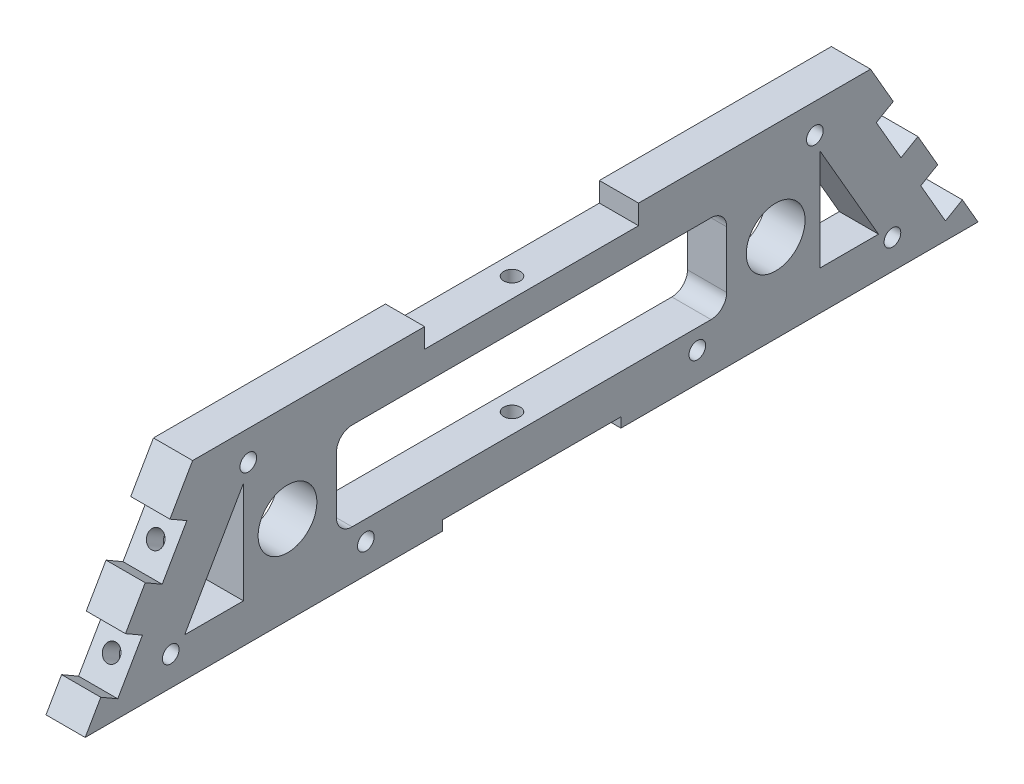
from build123d import *

# Parameters (mm, degrees)
SKETCH1_R                          = 4.7625
BOSS_EXTRUDE1_DEPTH                = 6.35
TAP_DRILL_FOR_6_32_TAP2_AT_2_COUNT = 2
TAP_DRILL_FOR_6_32_TAP2_AT_2_PITCH = 14.2875
SKETCH18_W                         = 63.246
SKETCH18_H                         = 14.2875
CUT_EXTRUDE1_DEPTH                 = 148.950291114
FILLET1_R                          = 2.54
TAP_DRILL_FOR_6_32_TAP4_D          = 2.7051
TAP_DRILL_FOR_6_32_TAP1_AT_2_COUNT = 2
TAP_DRILL_FOR_6_32_TAP1_AT_2_PITCH = 28.085742046
TAP_DRILL_FOR_6_32_TAP1_AT_3_COUNT = 2
TAP_DRILL_FOR_6_32_TAP1_AT_3_PITCH = 24.165817496
SKETCH23_W                         = 6.35
SKETCH23_H                         = 8.001
CUT_EXTRUDE2_DEPTH                 = 3.175


with BuildPart() as part:
    # Sketch1 → Boss-Extrude1 (new body)
    with BuildSketch(Plane(origin=(0, 0, 0), x_dir=(0, 0, -1), z_dir=(1, 0, 0))):
        Polygon((0, 0), (-17.414327494, 30.1625), (-55.0164, 30.1625), (-55.0164, 26.9875), (-89.6874, 26.9875), (-89.6874, 30.1625), (-127.289472506, 30.1625), (-144.7038, 0), (-86.8299, 0), (-86.8299, 1.5875), (-57.8739, 1.5875), (-57.8739, 0), align=None)
        with Locations((-111.9124, 14.2875)):
            Circle(SKETCH1_R, mode=Mode.SUBTRACT)
        with Locations((-32.7914, 14.2875)):
            Circle(SKETCH1_R, mode=Mode.SUBTRACT)
    extrude(amount=BOSS_EXTRUDE1_DEPTH)

    # Sketch14 → Tap Drill for #6-32 Tap2 (revolve, cut)
    with BuildSketch(Plane(origin=(3.175, 8.165454744, 139.989472506), x_dir=(0, -0.8660254037844365, 0.500000000000004), z_dir=(1, 0, 0))):
        Polygon((0, 0), (0, 7.16269403), (1.35255, 6.35), (1.35255, 0), align=None)
    tap_drill_for_6_32_tap2 = revolve(axis=Axis((3.175, 11.340454744, 145.48873382), (0, -0.5000000000000039, -0.8660254037844364)), mode=Mode.SUBTRACT)

    # Tap Drill for #6-32 Tap2 at 2: Tap Drill for #6-32 Tap2 ×2
    with Locations(*[Vector(0, 0.8660254037844364, -0.500000000000004) * (i * TAP_DRILL_FOR_6_32_TAP2_AT_2_PITCH) for i in range(1, TAP_DRILL_FOR_6_32_TAP2_AT_2_COUNT)]):
        add(tap_drill_for_6_32_tap2, mode=Mode.SUBTRACT)

    # Sketch18 → Cut-Extrude1 (cut, through all)
    with BuildSketch(Plane.ZY):
        Polygon((16.12265, 6.35), (25.64765, 6.35), (25.64765, 22.847783942), align=None)
        with Locations((72.3519, 15.08125)):
            Rectangle(SKETCH18_W, SKETCH18_H)
        Polygon((119.05615, 6.35), (119.05615, 22.847783942), (128.58115, 6.35), align=None)
    extrude(amount=-CUT_EXTRUDE1_DEPTH, mode=Mode.SUBTRACT)

    # Fillet1
    fillet1_edges = [part.edges().sort_by_distance(p)[0] for p in [
        (3.175, 7.9375, 40.7289),
        (3.175, 22.225, 40.7289),
        (3.175, 22.225, 103.9749),
        (3.175, 7.9375, 103.9749),
    ]]
    fillet(fillet1_edges, radius=FILLET1_R)

    # Tap Drill for #6-32 Tap4 (through all)
    with Locations(Plane(origin=(0, 26.9875, 0), x_dir=(1, 0, 0), z_dir=(0, 1, 0))):
        with Locations((3.175, -72.3519)):
            Hole(TAP_DRILL_FOR_6_32_TAP4_D / 2)

    # Mirror1: Tap Drill for #6-32 Tap2 across plane
    add(tap_drill_for_6_32_tap2.mirror(Plane(origin=(0, 0, 72.3519), x_dir=(1, 0, 0), z_dir=(0, 0, -1))), mode=Mode.SUBTRACT)

    # Mirror1 copy 1 sketch → Mirror1 copy 1 (revolve, cut)
    with BuildSketch(Plane(origin=(3.175, 20.5387927, 11.858077494), x_dir=(0, -0.8660254037844365, -0.500000000000004), z_dir=(1, 0, 0))):
        Polygon((0, 0), (0, -7.16269403), (1.35255, -6.35), (1.35255, 0), align=None)
    revolve(axis=Axis((3.175, 23.7137927, 6.35881618), (0, 0.5000000000000039, -0.8660254037844364)), mode=Mode.SUBTRACT)

    # Sketch12 → Tap Drill for #6-32 Tap1 (revolve, cut)
    with BuildSketch(Plane(origin=(6.35, 25.4, 118.2624), x_dir=(0, 0, -1), z_dir=(0, 1, 0))):
        Polygon((0, 0), (0, 7.16269403), (1.35255, 6.35), (1.35255, 0), align=None)
    tap_drill_for_6_32_tap1 = revolve(axis=Axis((12.7, 25.4, 118.2624), (-1, 0, 0)), mode=Mode.SUBTRACT)

    # Tap Drill for #6-32 Tap1 at 2: Tap Drill for #6-32 Tap1 ×2
    with Locations(*[Vector(0, -0.734803444627488, -0.6782801027330657) * (i * TAP_DRILL_FOR_6_32_TAP1_AT_2_PITCH) for i in range(1, TAP_DRILL_FOR_6_32_TAP1_AT_2_COUNT)]):
        add(tap_drill_for_6_32_tap1, mode=Mode.SUBTRACT)

    # Tap Drill for #6-32 Tap1 at 3: Tap Drill for #6-32 Tap1 ×2
    with Locations(*[Vector(0, -0.8539955250185772, 0.5202803506267027) * (i * TAP_DRILL_FOR_6_32_TAP1_AT_3_PITCH) for i in range(1, TAP_DRILL_FOR_6_32_TAP1_AT_3_COUNT)]):
        add(tap_drill_for_6_32_tap1, mode=Mode.SUBTRACT)

    # Mirror2: Tap Drill for #6-32 Tap1 across plane
    add(tap_drill_for_6_32_tap1.mirror(Plane(origin=(0, 0, 72.3519), x_dir=(1, 0, 0), z_dir=(0, 0, -1))), mode=Mode.SUBTRACT)

    # Mirror2 copy 1 sketch → Mirror2 copy 1 (revolve, cut)
    with BuildSketch(Plane(origin=(6.35, 4.7625, 45.4914), x_dir=(0, 0, 1), z_dir=(0, 1, 0))):
        Polygon((0, 0), (0, -7.16269403), (1.35255, -6.35), (1.35255, 0), align=None)
    revolve(axis=Axis((12.7, 4.7625, 45.4914), (1, 0, 0)), mode=Mode.SUBTRACT)

    # Mirror2 copy 2 sketch → Mirror2 copy 2 (revolve, cut)
    with BuildSketch(Plane(origin=(6.35, 4.7625, 13.8684), x_dir=(0, 0, 1), z_dir=(0, 1, 0))):
        Polygon((0, 0), (0, -7.16269403), (1.35255, -6.35), (1.35255, 0), align=None)
    revolve(axis=Axis((12.7, 4.7625, 13.8684), (1, 0, 0)), mode=Mode.SUBTRACT)

    # Sketch23 → Cut-Extrude2 (cut)
    with BuildSketch(Plane(origin=(0, 0, 0), x_dir=(-1, 0, 0), z_dir=(0, 0.49999999999999806, -0.8660254037844397))):
        with Locations((-3.175, 23.460115329)):
            Rectangle(SKETCH23_W, SKETCH23_H)
        with Locations((-3.175, 9.058315329)):
            Rectangle(SKETCH23_W, SKETCH23_H)
    cut_extrude2 = extrude(amount=-CUT_EXTRUDE2_DEPTH, mode=Mode.SUBTRACT)

    # Mirror3: Cut-Extrude2 across plane
    add(cut_extrude2.mirror(Plane(origin=(0, 0, 72.3519), x_dir=(1, 0, 0), z_dir=(0, 0, -1))), mode=Mode.SUBTRACT)


solid = part.part
